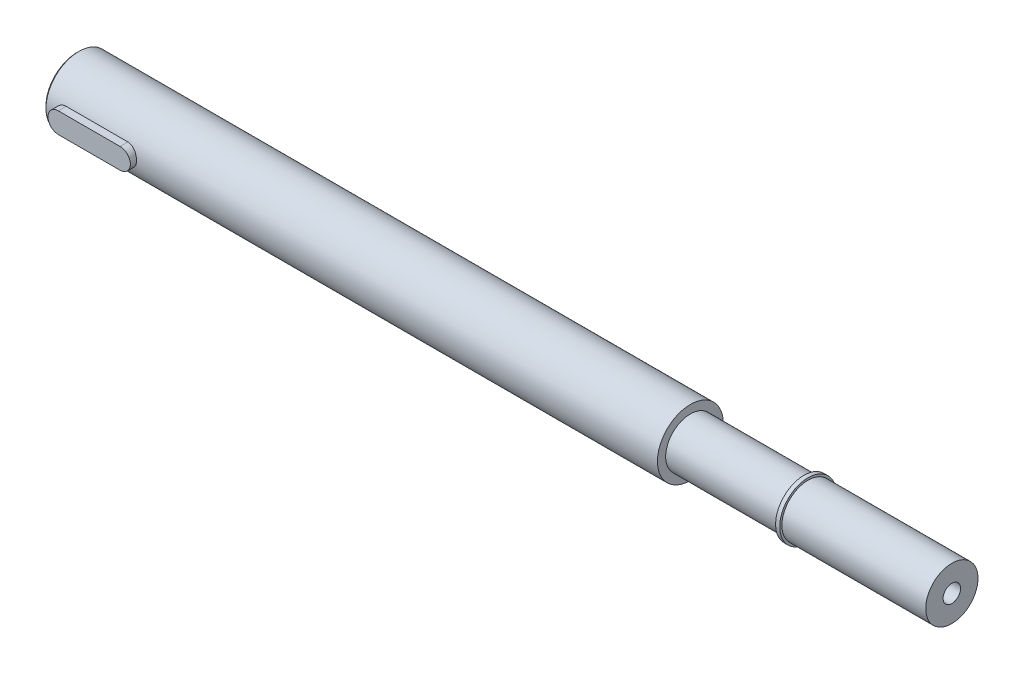
from build123d import *

# Parameters (mm, degrees)
BOSS_EXTRUDE1_DEPTH        = 10
M10X1_5_TAPPED_HOLE1_D     = 8.5
M10X1_5_TAPPED_HOLE1_DEPTH = 24.5
M10X1_5_TAPPED_HOLE1_TIP   = 2.553657631


with BuildPart() as part:
    # Sketch1 → Revolve1 (revolve)
    with BuildSketch(Plane.XY, mode=Mode.PRIVATE) as revolve1_sk:
        Polygon((0, 0), (-117.829393829, 0), (-117.829393829, 15), (-116.829393829, 16), (180.170606171, 16), (180.170606171, 12), (235.320606171, 12), (235.320606171, 13.75770445), (237.320606171, 13.75770445), (237.320606171, 12.7), (307.170606171, 12.7), (307.170606171, 11), (307.170606171, 0), align=None)
    revolve(revolve1_sk.sketch.rotate(Axis((0, 0, 0), (-1, 0, 0)), 90), axis=Axis((0, 0, 0), (-1, 0, 0)))

    # Sketch2 → Boss-Extrude1 (add)
    with BuildSketch(Plane.XY.offset(19)):
        with BuildLine():
            Line((-107.829393829, 5), (-77.829393829, 5))
            ThreePointArc((-77.829393829, 5), (-72.829393829, 0), (-77.829393829, -5))
            Line((-77.829393829, -5), (-107.829393829, -5))
            ThreePointArc((-107.829393829, -5), (-112.829393829, 0), (-107.829393829, 5))
        make_face()
    extrude(amount=-BOSS_EXTRUDE1_DEPTH)

    # M10x1.5 Tapped Hole1
    with Locations(Plane(origin=(307.170606171, 0, 0), x_dir=(0, 0, -1), z_dir=(1, 0, 0))):
        with Locations((0, 0)):
            Hole(M10X1_5_TAPPED_HOLE1_D / 2, depth=M10X1_5_TAPPED_HOLE1_DEPTH)
            with Locations((0, 0, -(M10X1_5_TAPPED_HOLE1_DEPTH + M10X1_5_TAPPED_HOLE1_TIP / 2))):  # 118° drill point
                Cone(0, M10X1_5_TAPPED_HOLE1_D / 2, M10X1_5_TAPPED_HOLE1_TIP, mode=Mode.SUBTRACT)


solid = part.part
